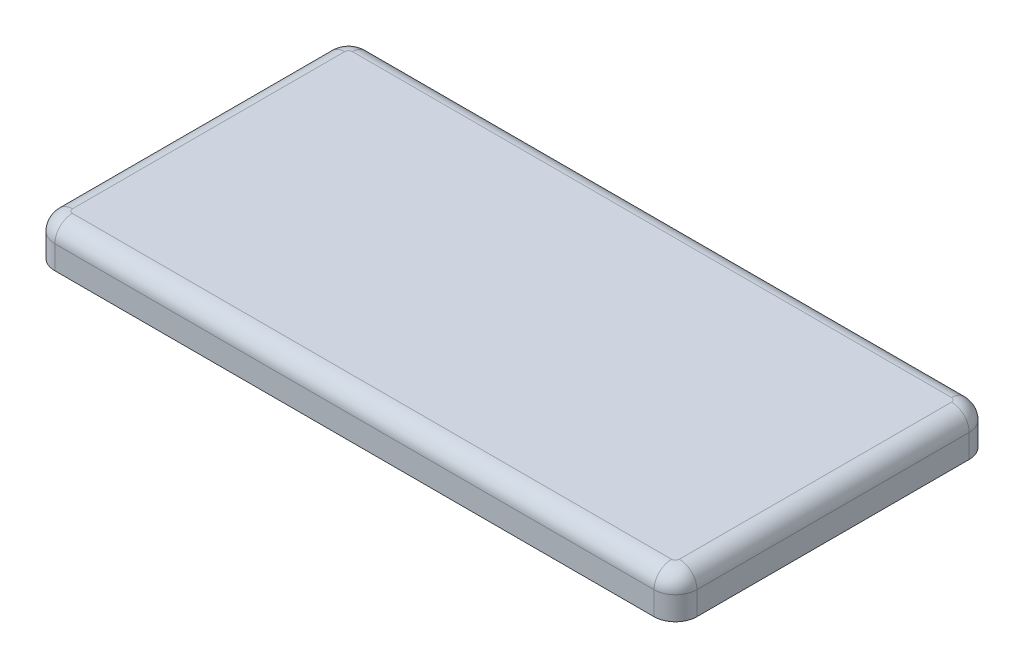
from build123d import *

# Parameters (mm, degrees)
EXTRUDE_1_DEPTH = 4.2
FILLET_1_R      = 1.8
SHELL_1_T       = -1


with BuildPart() as part:
    # 草图1 → 凸台-拉伸1 (new body)
    with BuildSketch(Plane(origin=(0, 0, 0), x_dir=(1, 0, 0), z_dir=(0, 1, 0))):
        with BuildLine():
            Line((-30.7, 16.15), (30.7, 16.15))
            ThreePointArc((30.7, 16.15), (32.255634919, 15.505634919), (32.9, 13.95))
            Line((32.9, 13.95), (32.9, -13.95))
            ThreePointArc((32.9, -13.95), (32.255634919, -15.505634919), (30.7, -16.15))
            Line((30.7, -16.15), (-30.7, -16.15))
            ThreePointArc((-30.7, -16.15), (-32.255634919, -15.505634919), (-32.9, -13.95))
            Line((-32.9, -13.95), (-32.9, 13.95))
            ThreePointArc((-32.9, 13.95), (-32.255634919, 15.505634919), (-30.7, 16.15))
        make_face()
    extrude(amount=EXTRUDE_1_DEPTH)

    # 圆角1
    fillet_1_edges = [part.edges().sort_by_distance(p)[0] for p in [
        (32.255634919, 4.2, 15.505634919),
        (32.9, 4.2, 0),
        (32.255634919, 4.2, -15.505634919),
        (0, 4.2, -16.15),
        (-32.255634919, 4.2, -15.505634919),
        (-32.9, 4.2, 0),
        (-32.255634919, 4.2, 15.505634919),
        (0, 4.2, 16.15),
    ]]
    fillet(fillet_1_edges, radius=FILLET_1_R)

    # 抽壳1
    shell_1_openings = [part.faces().sort_by_distance(p)[0] for p in [
        (0, 0, 0),
    ]]
    offset(amount=SHELL_1_T, openings=shell_1_openings, kind=Kind.INTERSECTION)


solid = part.part
